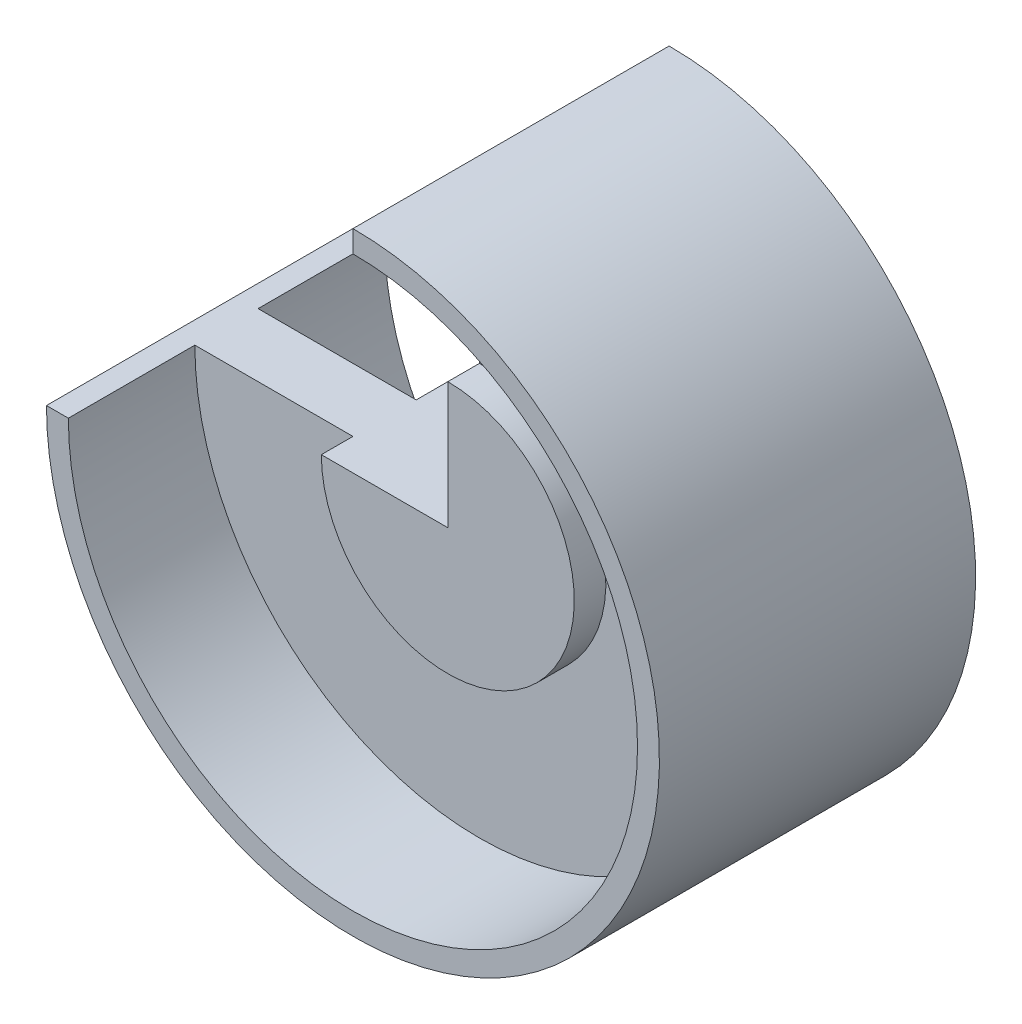
from build123d import *

# Parameters (mm, degrees)
REVOLVE1_ANGLE = 270


with BuildPart() as part:
    # Sketch1 → Revolve1 (revolve)
    with BuildSketch(Plane(origin=(0, 0, 0), x_dir=(0, 0, -1), z_dir=(1, 0, 0))):
        Polygon((20000, 1.841276289), (40000, 1.841276289), (40000, 20001.841276289), (35000, 20001.841276289), (35000, 45001.841276289), (55000, 45001.841276289), (55000, 48465.660552955), (5000, 48465.660552955), (5000, 45001.841276289), (25000, 45001.841276289), (25000, 20001.841276289), (20000, 20001.841276289), align=None)
    revolve(axis=Axis((0, 1.841276289, -20000), (0, 0, -1)), revolution_arc=REVOLVE1_ANGLE)


solid = part.part
